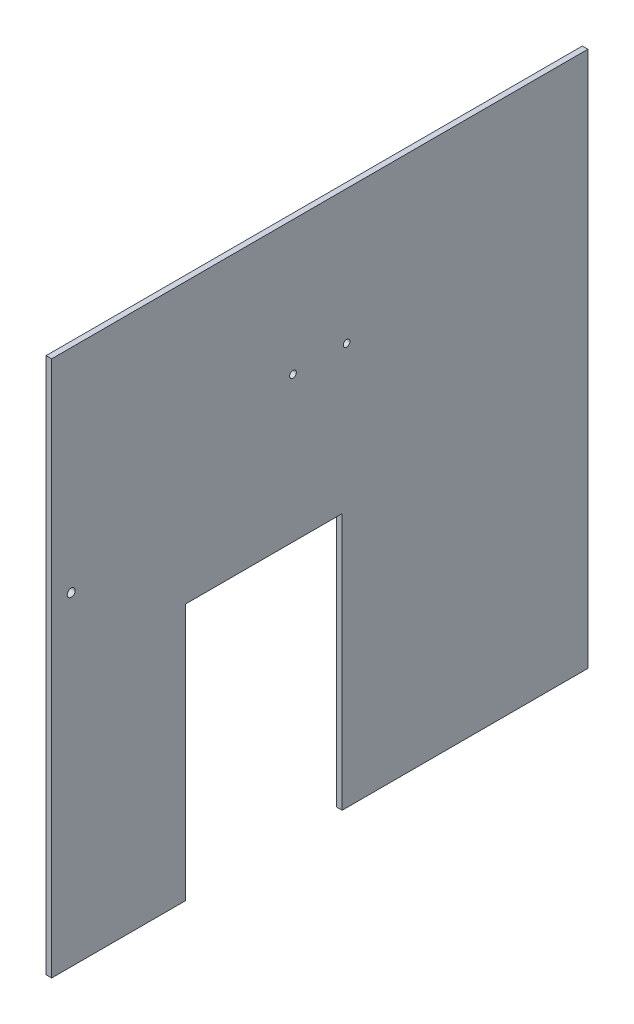
from build123d import *

# Parameters (mm, degrees)
BOSS_EXTRUDE1_DEPTH       = 3.175
SKETCH2_R                 = 2.286
CUT_EXTRUDE1_DEPTH        = 216.549531721
F_6_0_15_DIAMETER_HOLE1_D = 3.81


with BuildPart() as part:
    # Sketch1 → Boss-Extrude1 (new body)
    with BuildSketch(Plane(origin=(0, 0, 0), x_dir=(0, 0, -1), z_dir=(1, 0, 0))):
        Polygon((152.4, 152.4), (-152.4, 152.4), (-152.4, -152.4), (-76.2, -152.4), (-76.2, -6.35), (12.7, -6.35), (12.7, -152.4), (152.4, -152.4), align=None)
    extrude(amount=BOSS_EXTRUDE1_DEPTH)

    # Sketch2 → Cut-Extrude1 (cut, through all)
    with BuildSketch(Plane(origin=(3.175, 0, 0), x_dir=(0, 0, -1), z_dir=(1, 0, 0))):
        with Locations((-141.2875, 31.75)):
            Circle(SKETCH2_R)
    extrude(amount=-CUT_EXTRUDE1_DEPTH, mode=Mode.SUBTRACT)

    # #6 (0.15) Diameter Hole1 (through all)
    with Locations(Plane(origin=(3.175, 0, 0), x_dir=(0, 0, -1), z_dir=(1, 0, 0))):
        with Locations((-15.24, 76.2), (15.24, 76.2)):
            Hole(F_6_0_15_DIAMETER_HOLE1_D / 2)


solid = part.part
